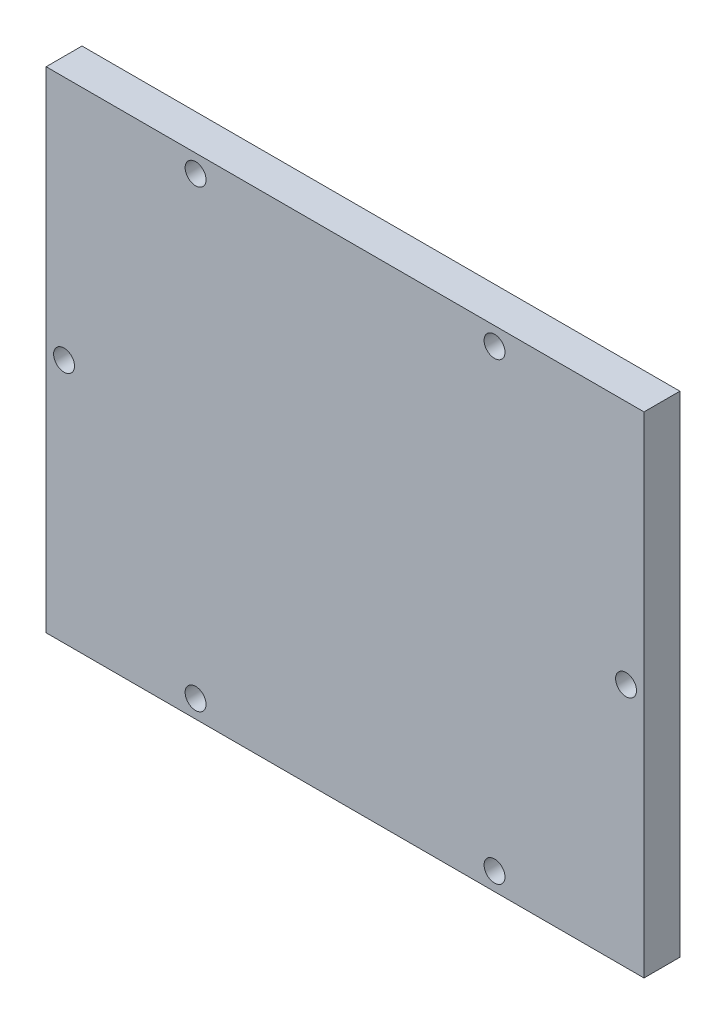
from build123d import *

# Parameters (mm, degrees)
ESQUISSE1_W             = 100
ESQUISSE1_H             = 82
BOSS_EXTRU_1_DEPTH      = 6
ESQUISSE2_R             = 1.75
ENL_V_MAT_EXTRU_1_DEPTH = 6
ESQUISSE3_R             = 1.75
ENL_V_MAT_EXTRU_2_DEPTH = 6


with BuildPart() as part:
    # Esquisse1 → Boss.-Extru.1 (new body)
    with BuildSketch(Plane.XY):
        Rectangle(ESQUISSE1_W, ESQUISSE1_H)
    extrude(amount=BOSS_EXTRU_1_DEPTH)

    # Esquisse2 → Enlèv. mat.-Extru.1 (cut)
    with BuildSketch(Plane.XY):
        with Locations(Location((-25, -38, 0), (0, 0, 180))):
            Circle(ESQUISSE2_R)
        with Locations(Location((25, -38, 0), (0, 0, 180))):
            Circle(ESQUISSE2_R)
        with Locations(Location((-25, 38, 0), (0, 0, 180))):
            Circle(ESQUISSE2_R)
        with Locations(Location((25, 38, 0), (0, 0, 180))):
            Circle(ESQUISSE2_R)
    extrude(amount=ENL_V_MAT_EXTRU_1_DEPTH, mode=Mode.SUBTRACT)

    # Esquisse3 → Enlèv. mat.-Extru.2 (cut)
    with BuildSketch(Plane.XY):
        with Locations(Location((47, 0, 0), (0, 0, 180))):
            Circle(ESQUISSE3_R)
    enl_v_mat_extru_2 = extrude(amount=ENL_V_MAT_EXTRU_2_DEPTH, mode=Mode.SUBTRACT)

    # Symétrie1: Enlèv. mat.-Extru.2 across plane
    add(enl_v_mat_extru_2.mirror(Plane(origin=(0, 0, 0), x_dir=(0, 0, 1), z_dir=(1, 0, 0))), mode=Mode.SUBTRACT)


solid = part.part
